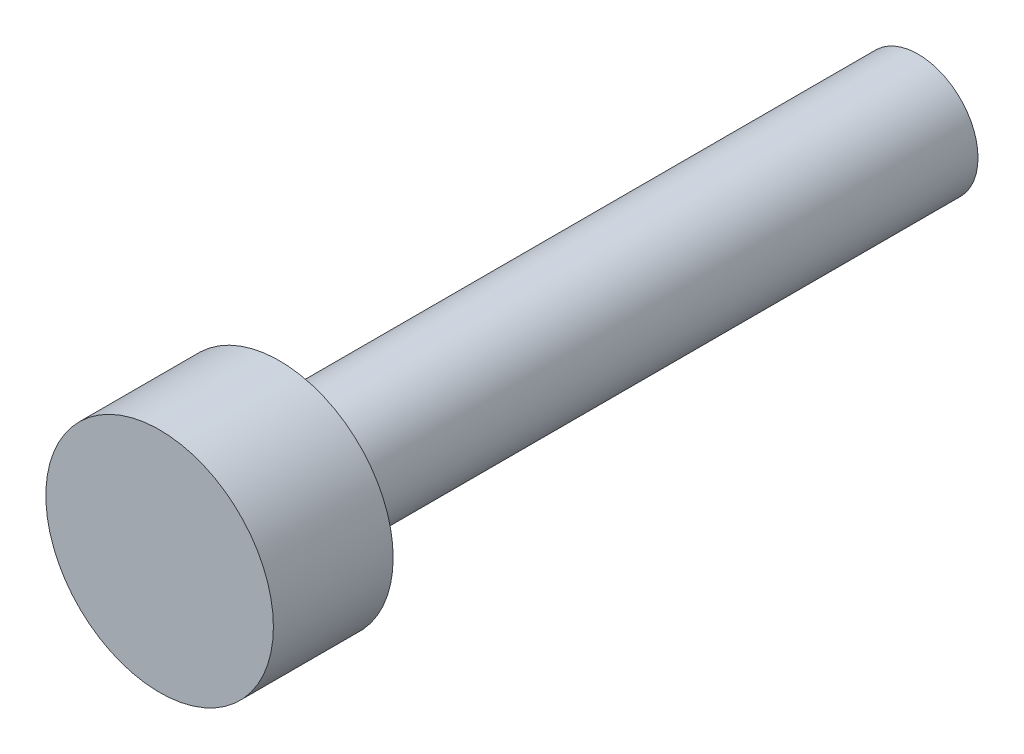
from build123d import *

# Parameters (mm, degrees)
SKETCH1_R           = 1.5
BOSS_EXTRUDE1_DEPTH = 16
SKETCH2_R           = 2.85
BOSS_EXTRUDE2_DEPTH = 3


with BuildPart() as part:
    # Sketch1 → Boss-Extrude1 (new body)
    with BuildSketch(Plane.XY):
        Circle(SKETCH1_R)
    extrude(amount=BOSS_EXTRUDE1_DEPTH)

    # Sketch2 → Boss-Extrude2 (add)
    with BuildSketch(Plane.XY.offset(16)):
        Circle(SKETCH2_R)
    extrude(amount=BOSS_EXTRUDE2_DEPTH)


solid = part.part
